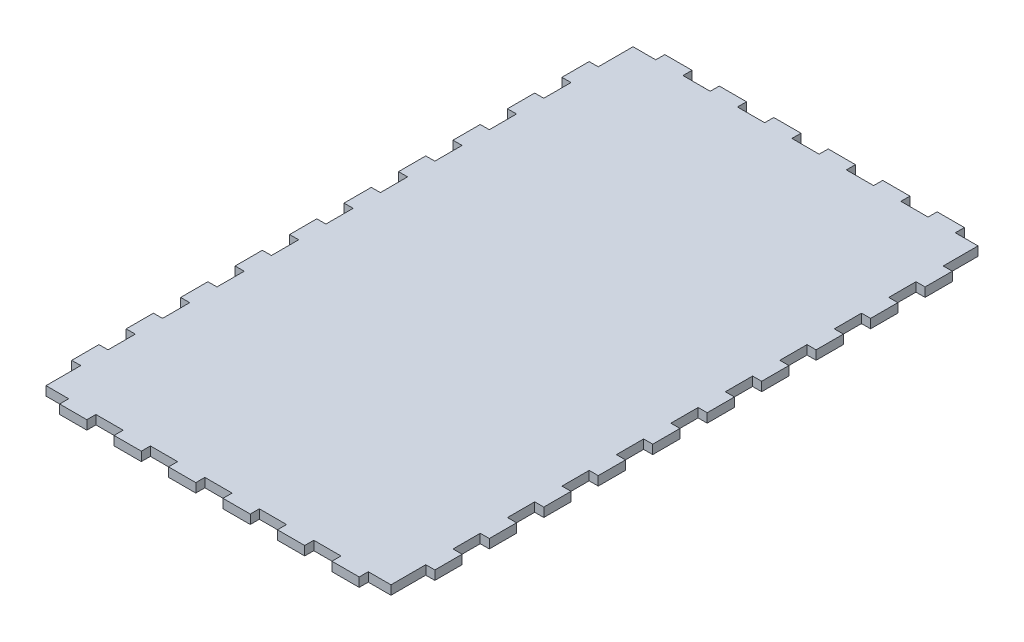
from build123d import *

# Parameters (mm, degrees)
BOSS_EXTRUDE1_DEPTH = 1.5


with BuildPart() as part:
    # Sketch1 → Boss-Extrude1 (new, symmetric)
    with BuildSketch(Plane(origin=(0, 0, 0), x_dir=(1, 0, 0), z_dir=(0, 1, 0))):
        Polygon((49.5, 100), (40.5, 100), (40.5, 97), (31.5, 97), (31.5, 100), (22.5, 100), (22.5, 97), (13.5, 97), (13.5, 100), (4.5, 100), (4.5, 97), (-4.5, 97), (-4.5, 100), (-13.5, 100), (-13.5, 97), (-22.5, 97), (-22.5, 100), (-31.5, 100), (-31.5, 97), (-40.5, 97), (-40.5, 100), (-49.5, 100), (-49.5, 97), (-57, 97), (-57, 85.5), (-60, 85.5), (-60, 76.5), (-57, 76.5), (-57, 67.5), (-60, 67.5), (-60, 58.5), (-57, 58.5), (-57, 49.5), (-60, 49.5), (-60, 40.5), (-57, 40.5), (-57, 31.5), (-60, 31.5), (-60, 22.5), (-57, 22.5), (-57, 13.5), (-60, 13.5), (-60, 4.5), (-57, 4.5), (-57, -4.5), (-60, -4.5), (-60, -13.5), (-57, -13.5), (-57, -22.5), (-60, -22.5), (-60, -31.5), (-57, -31.5), (-57, -40.5), (-60, -40.5), (-60, -49.5), (-57, -49.5), (-57, -58.5), (-60, -58.5), (-60, -67.5), (-57, -67.5), (-57, -76.5), (-60, -76.5), (-60, -85.5), (-57, -85.5), (-57, -97), (-49.5, -97), (-49.5, -100), (-40.5, -100), (-40.5, -97), (-31.5, -97), (-31.5, -100), (-22.5, -100), (-22.5, -97), (-13.5, -97), (-13.5, -100), (-4.5, -100), (-4.5, -97), (4.5, -97), (4.5, -100), (13.5, -100), (13.5, -97), (22.5, -97), (22.5, -100), (31.5, -100), (31.5, -97), (40.5, -97), (40.5, -100), (49.5, -100), (49.5, -97), (57, -97), (57, -85.5), (60, -85.5), (60, -76.5), (57, -76.5), (57, -67.5), (60, -67.5), (60, -58.5), (57, -58.5), (57, -49.5), (60, -49.5), (60, -40.5), (57, -40.5), (57, -31.5), (60, -31.5), (60, -22.5), (57, -22.5), (57, -13.5), (60, -13.5), (60, -4.5), (57, -4.5), (57, 4.5), (60, 4.5), (60, 13.5), (57, 13.5), (57, 22.5), (60, 22.5), (60, 31.5), (57, 31.5), (57, 40.5), (60, 40.5), (60, 49.5), (57, 49.5), (57, 58.5), (60, 58.5), (60, 67.5), (57, 67.5), (57, 76.5), (60, 76.5), (60, 85.5), (57, 85.5), (57, 97), (49.5, 97), align=None)
    extrude(amount=BOSS_EXTRUDE1_DEPTH, both=True)


solid = part.part
